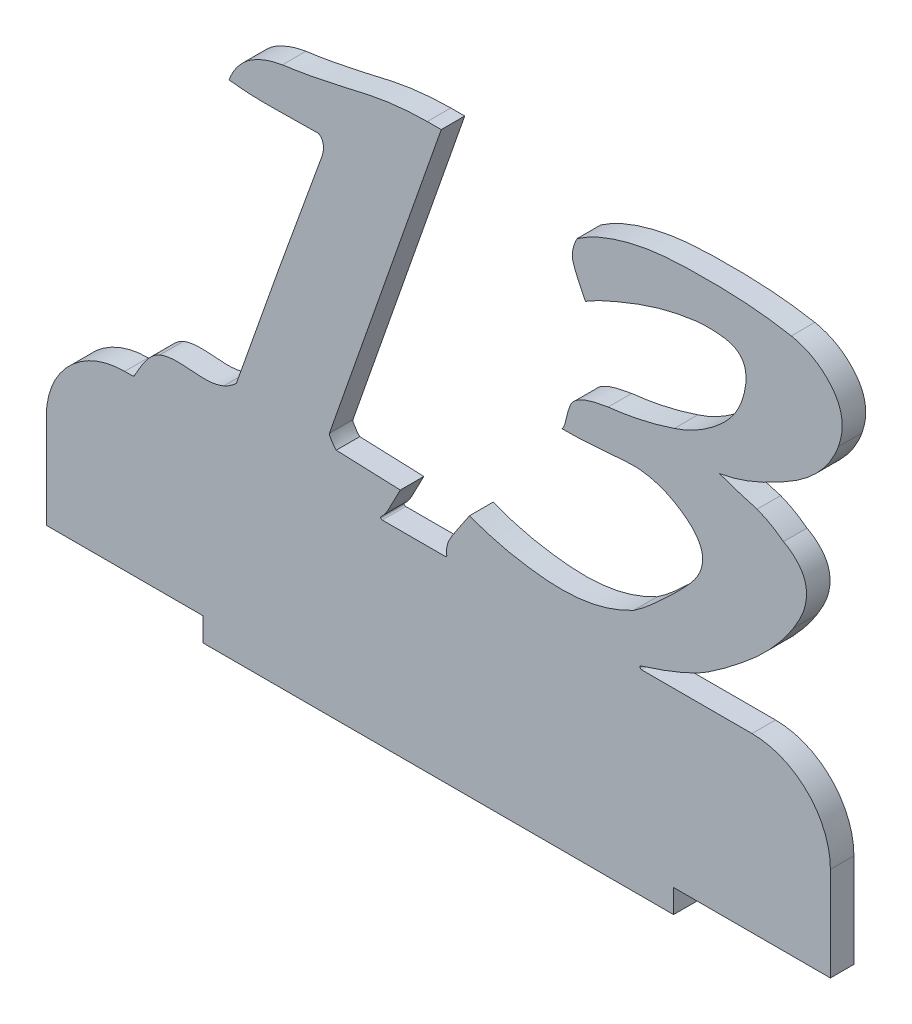
from build123d import *

# Parameters (mm, degrees)
BOSS_EXTRUDE1_DEPTH = 3
FILLET1_R           = 10
FILLET2_R           = 0.2


with BuildPart() as part:
    # Sketch1 → Boss-Extrude1 (new body)
    with BuildSketch(Plane.XY):
        with BuildLine():
            Line((42.209267113, 22.000000982), (51.125141381, 22.000000982))
            add(Edge.make_bspline(
                [(51.125141381, 22.000000982), (51.054696229, 22.270222152), (51.010201429, 22.881283297), (51.241265982, 23.845356663), (52.269008498, 25.590678848), (53.280220729, 26.939714453), (53.985653593, 28.053787596)],
                knots=[0.116796187, 0.116796187, 0.116796187, 0.116796187, 0.224395637, 0.348056594, 0.492966758, 1, 1, 1, 1], degree=3))
            add(Edge.make_bspline(
                [(53.985653593, 28.053787596), (55.641828517, 27.413505224), (58.20638577, 26.63360286), (61.746915817, 26.052516311), (64.454567819, 25.754368885), (67.185502225, 25.764564328), (70.767057479, 26.254121388), (73.316027786, 27.209105613), (74.900430763, 28.053787596)],
                knots=[0, 0, 0, 0, 0.247124859, 0.371259261, 0.498795594, 0.625702225, 0.750177044, 1, 1, 1, 1], degree=3))
            add(Edge.make_bspline(
                [(74.900430763, 28.053787596), (75.98480277, 28.773907904), (77.596209589, 30.168465), (79.851892893, 32.275066645), (81.448313454, 33.881479066), (82.670743913, 35.266077902), (83.322254068, 36.334154971), (83.67544977, 37.383471581), (83.752107906, 38.408027184), (83.489894617, 39.403726019), (82.712054089, 40.753406848), (81.736803703, 41.541285755), (81.038038268, 42.02954991)],
                knots=[0, 0, 0, 0, 0.209310503, 0.343078083, 0.497575291, 0.574369076, 0.640301696, 0.697766983, 0.751429678, 0.803400302, 0.861248312, 1, 1, 1, 1], degree=3))
            add(Edge.make_bspline(
                [(81.038038268, 42.02954991), (79.938271335, 42.786677417), (78.121225351, 43.651633037), (75.497771574, 44.095676429), (71.600178017, 43.895076003), (68.388986847, 43.479511964), (65.791752107, 43.554178526)],
                knots=[0, 0, 0, 0, 0.255382353, 0.37922334, 0.505212288, 1, 1, 1, 1], degree=3))
            add(Edge.make_bspline(
                [(65.791752107, 43.554178526), (66.094490102, 43.988896457), (66.358302576, 45.030844209), (66.573136718, 46.073733372), (66.788624664, 46.583889238)],
                knots=[0, 0, 0, 0, 0.485390366, 1, 1, 1, 1], degree=3))
            add(Edge.make_bspline(
                [(66.788624664, 46.583889238), (67.044982602, 47.271098843), (68.641426793, 48.391444794), (70.510761077, 48.679729911), (71.655708323, 48.890378683)],
                knots=[0, 0, 0, 0, 0.373077534, 1, 1, 1, 1], degree=3))
            add(Edge.make_bspline(
                [(71.655708323, 48.890378683), (75.981373334, 49.349011938), (80.099805274, 50.747298151)],
                knots=[0, 0, 0, 1, 1, 1], degree=2))
            add(Edge.make_bspline(
                [(80.099805274, 50.747298151), (81.156915857, 51.0799737), (82.707853032, 51.780290014), (84.626382679, 53.043014313), (86.028715233, 54.15974007), (87.279464059, 55.442437933), (88.588262295, 57.39824023), (89.077285581, 59.100793116), (89.208483929, 60.24690722)],
                knots=[0, 0, 0, 0, 0.239109959, 0.365172213, 0.495269351, 0.625647748, 0.750534367, 1, 1, 1, 1], degree=3))
            add(Edge.make_bspline(
                [(89.208483929, 60.24690722), (89.294094349, 61.046779909), (89.197912044, 62.394657339), (87.977946562, 63.529961027), (86.795100758, 63.923587879), (85.434395931, 64.054801072), (83.933637572, 64.118118031), (82.313735749, 63.927797333), (80.002523342, 63.542593384), (77.041503993, 62.756796075), (74.180459283, 61.694509647), (72.049306829, 60.770760932), (70.416156354, 60.062053487), (69.364103731, 59.482638029), (68.762823257, 59.113209019)],
                knots=[0, 0, 0, 0, 0.105860809, 0.151148094, 0.202066113, 0.259997274, 0.323222608, 0.390850349, 0.464934646, 0.618432313, 0.775800913, 0.848983913, 0.911074804, 1, 1, 1, 1], degree=3))
            add(Edge.make_bspline(
                [(68.762823257, 59.113209019), (68.287522386, 60.144002762), (67.591650046, 61.366557123), (67.075917585, 62.979340581), (67.09900455, 64.149521621), (67.414075399, 64.991730173), (67.707311138, 65.524467815)],
                knots=[0, 0, 0, 0, 0.496027357, 0.614229882, 0.73389997, 1, 1, 1, 1], degree=3))
            add(Edge.make_bspline(
                [(67.707311138, 65.524467815), (69.502344817, 66.756070223), (72.645061593, 68.037016718), (77.218750853, 69.005812031), (81.033179467, 69.277718075), (84.869611671, 69.323674446), (89.551716095, 69.188653209), (92.90345154, 68.81911557), (95.013800583, 68.417352881)],
                knots=[0, 0, 0, 0, 0.231433242, 0.359702201, 0.498957825, 0.639815328, 0.770265834, 1, 1, 1, 1], degree=3))
            add(Edge.make_bspline(
                [(95.013800583, 68.417352881), (96.05325701, 68.205067322), (97.568396376, 67.661435243), (99.255103568, 66.388084045), (100.328353345, 65.256107359), (101.132412592, 63.924937962), (101.694934332, 61.855890462), (101.392747928, 60.213627363), (101.014582444, 59.191395102)],
                knots=[0, 0, 0, 0, 0.252437657, 0.373944377, 0.498634879, 0.620593116, 0.739092813, 1, 1, 1, 1], degree=3))
            add(Edge.make_bspline(
                [(101.014582444, 59.191395102), (100.521106495, 57.783681135), (99.270877976, 55.809432636), (96.934945217, 53.613527748), (94.753149839, 52.175187003), (92.446801264, 50.930311527), (89.532040793, 49.57495342), (87.310134357, 48.887883917), (85.846482365, 48.636273913)],
                knots=[0, 0, 0, 0, 0.231687999, 0.359129433, 0.498309405, 0.638597779, 0.768407197, 1, 1, 1, 1], degree=3))
            add(Edge.make_bspline(
                [(85.846482365, 48.636273913), (86.722865627, 48.372857111), (88.290862541, 47.756876804), (89.918048435, 47.323191572), (90.654926462, 47.111645297)],
                knots=[0, 0, 0, 0, 0.543939758, 1, 1, 1, 1], degree=3))
            add(Edge.make_bspline(
                [(90.654926462, 47.111645297), (92.481145724, 46.406525109), (94.016928026, 45.196086267)],
                knots=[0, 0, 0, 1, 1, 1], degree=2))
            add(Edge.make_bspline(
                [(94.016928026, 45.196086267), (94.792161474, 44.795194652), (95.788263688, 44.001934713), (96.669446209, 42.623150551), (96.958203266, 41.513176856), (96.968410512, 40.316542129), (96.586446291, 38.476750337), (95.842915495, 37.163542004), (95.287451873, 36.282872819)],
                knots=[0, 0, 0, 0, 0.250144104, 0.357668588, 0.46435922, 0.57479225, 0.698847353, 1, 1, 1, 1], degree=3))
            add(Edge.make_bspline(
                [(95.287451873, 36.282872819), (94.46776896, 34.983662395), (93.008586672, 33.137348314), (90.747466144, 30.874384043), (88.863050814, 29.284380153), (87.0388799, 27.849650032), (85.094725444, 26.445119852), (83.761644966, 25.56504813), (82.934050778, 25.141356009)],
                knots=[0, 0, 0, 0, 0.274284974, 0.419249351, 0.571241075, 0.71478044, 0.834077755, 1, 1, 1, 1], degree=3))
            add(Edge.make_bspline(
                [(82.934050778, 25.141356009), (80.732452498, 24.058423634), (77.926783371, 23.00444296), (75.061907524, 22.148473135), (74.543847348, 22.000000982)],
                knots=[0, 0, 0, 0, 0.226937124, 0.276836808, 0.276836808, 0.276836808, 0.276836808], degree=3))
            Line((74.543847348, 22.000000982), (90.110220598, 22.000000982))
            Line((90.110220598, 22.000000982), (100, 22.000000982))
            Line((100, 22.000000982), (100, 0))
            Line((100, 0), (80, 0))
            Line((80, 0), (80, -3))
            Line((80, -3), (20, -3))
            Line((20, -3), (20, 0))
            Line((20, 0), (0, 0))
            Line((0, 0), (0, 22.000000982))
            Line((0, 22.000000982), (11.148788935, 22.000000982))
            add(Edge.make_bspline(
                [(11.148788935, 22.000000982), (11.294093963, 22.236428195), (11.681596581, 22.908976789), (12.546741038, 24.460954151), (13.541360372, 25.630564962), (14.482135219, 26.060042482)],
                knots=[0.10999239, 0.10999239, 0.10999239, 0.10999239, 0.24891213, 0.498932816, 1, 1, 1, 1], degree=3))
            add(Edge.make_bspline(
                [(14.482135219, 26.060042482), (15.823503513, 26.579306493), (18.574241278, 26.304538433), (21.343574701, 26.148890333), (22.65258088, 26.724624187)],
                knots=[0, 0, 0, 0, 0.501451854, 1, 1, 1, 1], degree=3))
            add(Edge.make_bspline(
                [(22.65258088, 26.724624187), (23.534123817, 27.11513674), (24.235849058, 27.780136306)],
                knots=[0, 0, 0, 1, 1, 1], degree=2))
            add(Edge.make_bspline(
                [(24.235849058, 27.780136306), (26.018144937, 32.815309306), (29.543142139, 42.938110561), (33.232170132, 53.002307312), (35.064621537, 58.0576969)],
                knots=[0, 0, 0, 0, 0.498322561, 1, 1, 1, 1], degree=3))
            add(Edge.make_bspline(
                [(35.064621537, 58.0576969), (35.247798602, 58.555235113), (35.54298473, 59.521810887), (35.090390958, 60.433206359), (34.732330684, 60.637837635)],
                knots=[0, 0, 0, 0, 0.581397084, 1, 1, 1, 1], degree=3))
            add(Edge.make_bspline(
                [(34.732330684, 60.637837635), (32.815609802, 60.671634707), (29.010618922, 60.487726304), (25.197637203, 60.592463181), (23.317162584, 60.833302842)],
                knots=[0, 0, 0, 0, 0.503014916, 1, 1, 1, 1], degree=3))
            add(Edge.make_bspline(
                [(23.317162584, 60.833302842), (23.549125094, 61.500475337), (24.033368704, 62.449429372), (24.951362819, 63.510165544), (25.724646561, 64.23269058), (26.672608253, 64.786399171), (28.099626264, 65.469098793), (29.291683944, 65.783915667), (30.119351795, 65.915398229)],
                knots=[0, 0, 0, 0, 0.237267367, 0.352023708, 0.469658656, 0.590380818, 0.718477308, 1, 1, 1, 1], degree=3))
            add(Edge.make_bspline(
                [(30.119351795, 65.915398229), (33.23161782, 66.313835372), (37.093385414, 67.16583933), (41.715184968, 68.245653535), (44.795086063, 68.72812928), (47.088177356, 68.875679719), (48.590813874, 68.886469378)],
                knots=[0, 0, 0, 0, 0.501477793, 0.632810111, 0.759518477, 1, 1, 1, 1], degree=3))
            add(Edge.make_bspline(
                [(48.590813874, 68.886469378), (48.799310095, 68.886469378), (49.392221224, 68.886469378), (49.985132352, 68.886469378), (50.36954726, 68.886469378)],
                knots=[0, 0, 0, 0, 0.351648352, 1, 1, 1, 1], degree=3))
            Line((50.36954726, 68.886469378), (36.120133655, 28.249252803))
            add(Edge.make_bspline(
                [(36.120133655, 28.249252803), (36.066951001, 28.049456308), (36.398590736, 27.539763249), (36.676281084, 27.056980375), (36.980180567, 26.783263749)],
                knots=[0, 0, 0, 0, 0.324502414, 1, 1, 1, 1], degree=3))
            Line((36.980180567, 26.783263749), (45.150626228, 26.470519417))
            add(Edge.make_bspline(
                [(45.150626228, 26.470519417), (44.555686662, 25.457300293), (44.010526555, 24.135060911), (43.112550269, 22.66886482), (42.612491127, 22.256566128), (42.298803246, 22.05375971), (42.209267113, 22.000000982)],
                knots=[0, 0, 0, 0, 0.504343167, 0.619768133, 0.735364226, 0.780343137, 0.780343137, 0.780343137, 0.780343137], degree=3))
        make_face()
    extrude(amount=BOSS_EXTRUDE1_DEPTH)

    # Fillet1
    fillet1_edges = [part.edges().sort_by_distance(p)[0] for p in [
        (100, 22.000000982, 1.5),
        (0, 22.000000982, 1.5),
    ]]
    fillet(fillet1_edges, radius=FILLET1_R)

    # Fillet2
    fillet2_edges = [part.edges().sort_by_distance(p)[0] for p in [
        (74.543847348, 22.000000982, 1.5),
        (42.209267113, 22.000000982, 1.5),
        (51.125141381, 22.000000982, 1.5),
        (11.148788935, 22.000000982, 1.5),
    ]]
    fillet(fillet2_edges, radius=FILLET2_R)


solid = part.part
